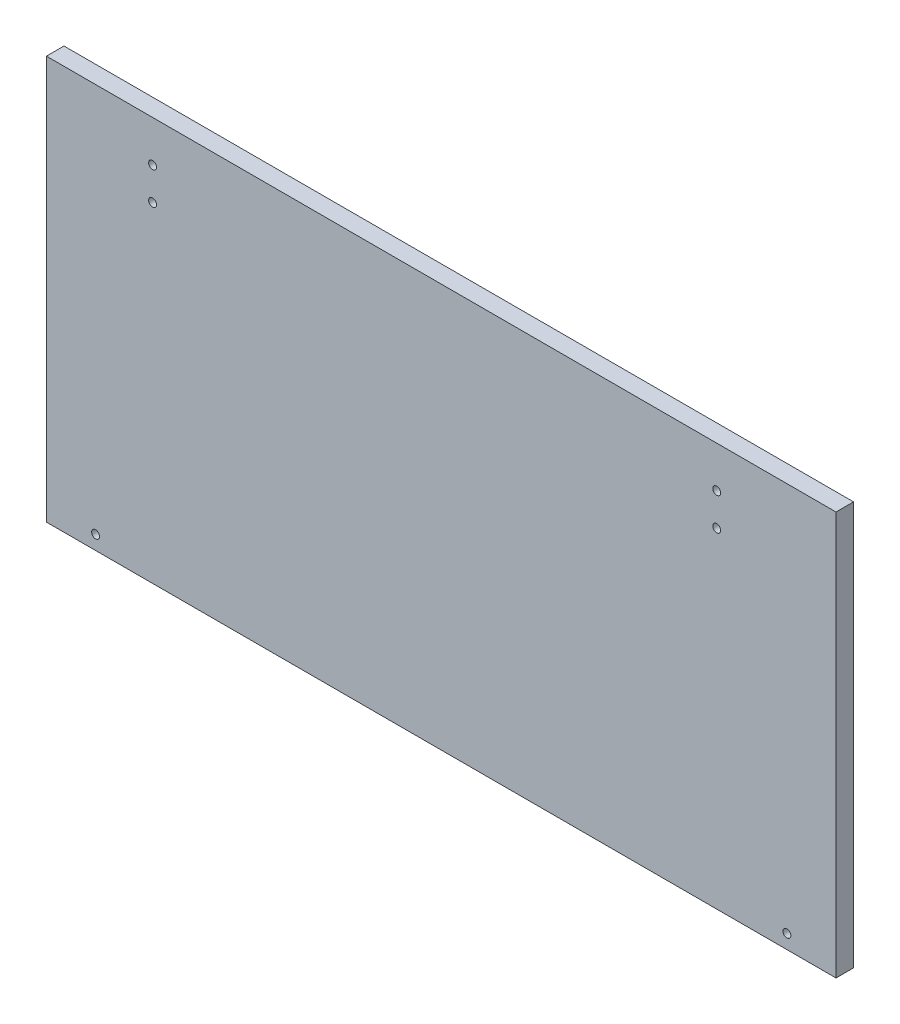
from build123d import *

# Parameters (mm, degrees)
SCHIZZO1_W                   = 450
SCHIZZO1_H                   = 230
ESTRUSIONE_ESTRUSIONE1_DEPTH = 10
SCHIZZO2_R                   = 2.25
TAGLIO_ESTRUSIONE1_DEPTH     = 10
SCHIZZO3_R                   = 2.25
TAGLIO_ESTRUSIONE2_DEPTH     = 10


with BuildPart() as part:
    # Schizzo1 → Estrusione-Estrusione1 (new body)
    with BuildSketch(Plane.XY):
        Rectangle(SCHIZZO1_W, SCHIZZO1_H)
    extrude(amount=ESTRUSIONE_ESTRUSIONE1_DEPTH)

    # Schizzo2 → Taglio-Estrusione1 (cut)
    with BuildSketch(Plane.XY.offset(10)):
        with Locations((-164.5, 91.5)):
            Circle(SCHIZZO2_R)
        with Locations((-164.5, 73)):
            Circle(SCHIZZO2_R)
        with Locations((157, 91.5)):
            Circle(SCHIZZO2_R)
        with Locations((157, 73)):
            Circle(SCHIZZO2_R)
    extrude(amount=-TAGLIO_ESTRUSIONE1_DEPTH, mode=Mode.SUBTRACT)

    # Schizzo3 → Taglio-Estrusione2 (cut)
    with BuildSketch(Plane.XY.offset(10)):
        with Locations((-197, -107)):
            Circle(SCHIZZO3_R)
        with Locations((197, -107)):
            Circle(SCHIZZO3_R)
    extrude(amount=-TAGLIO_ESTRUSIONE2_DEPTH, mode=Mode.SUBTRACT)


solid = part.part
